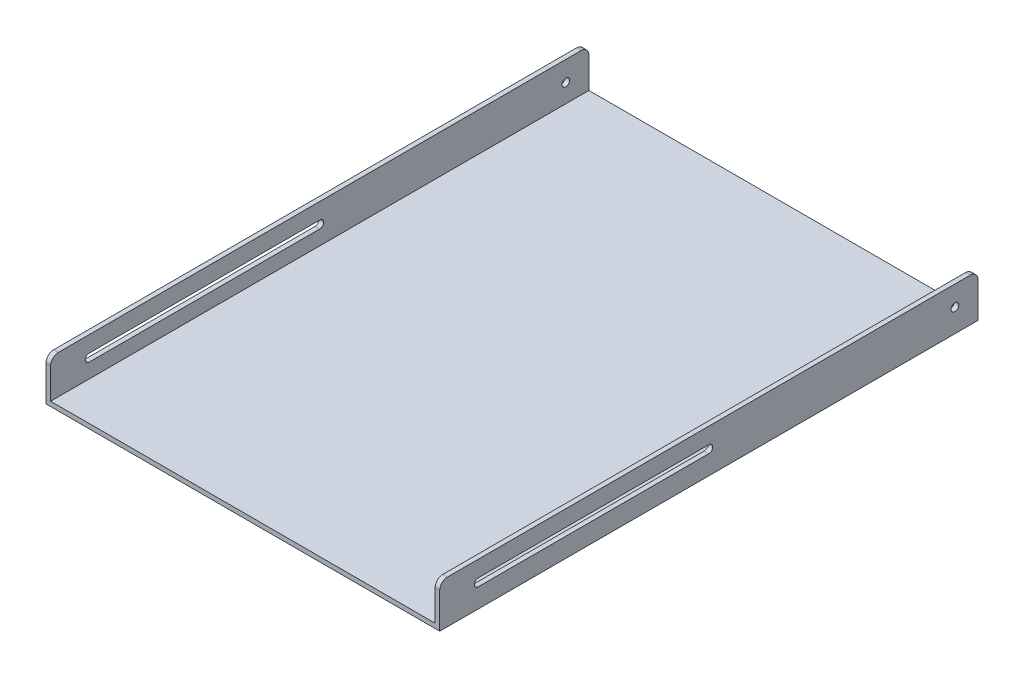
from build123d import *

# Parameters (mm, degrees)
EXTRUDE_THIN1_DEPTH = 350
SKETCH2_R           = 5
CUT_EXTRUDE1_DEPTH  = 623.208968113
FILLET1_R           = 10


with BuildPart() as part:
    # Sketch1 → Extrude-Thin1 (new, symmetric)
    with BuildSketch(Plane.XY):
        Polygon((250, 50), (250, 0), (-250, 0), (-250, 50), (-256, 50), (-256, -6), (256, -6), (256, 50), align=None)
    extrude(amount=EXTRUDE_THIN1_DEPTH, both=True)

    # Sketch2 → Cut-Extrude1 (cut, through all)
    with BuildSketch(Plane(origin=(256, 0, 0), x_dir=(0, 0, -1), z_dir=(1, 0, 0))):
        with Locations((320, 24)):
            Circle(SKETCH2_R)
        with BuildLine():
            Line((0, 19), (-300, 19))
            ThreePointArc((-300, 19), (-305, 24), (-300, 29))
            Line((-300, 29), (0, 29))
            ThreePointArc((0, 29), (5, 24), (0, 19))
        make_face()
    extrude(amount=-CUT_EXTRUDE1_DEPTH, mode=Mode.SUBTRACT)

    # Fillet1
    fillet1_edges = [part.edges().sort_by_distance(p)[0] for p in [
        (-253, 50, 350),
        (-253, 50, -350),
        (253, 50, 350),
        (253, 50, -350),
    ]]
    fillet(fillet1_edges, radius=FILLET1_R)


solid = part.part
